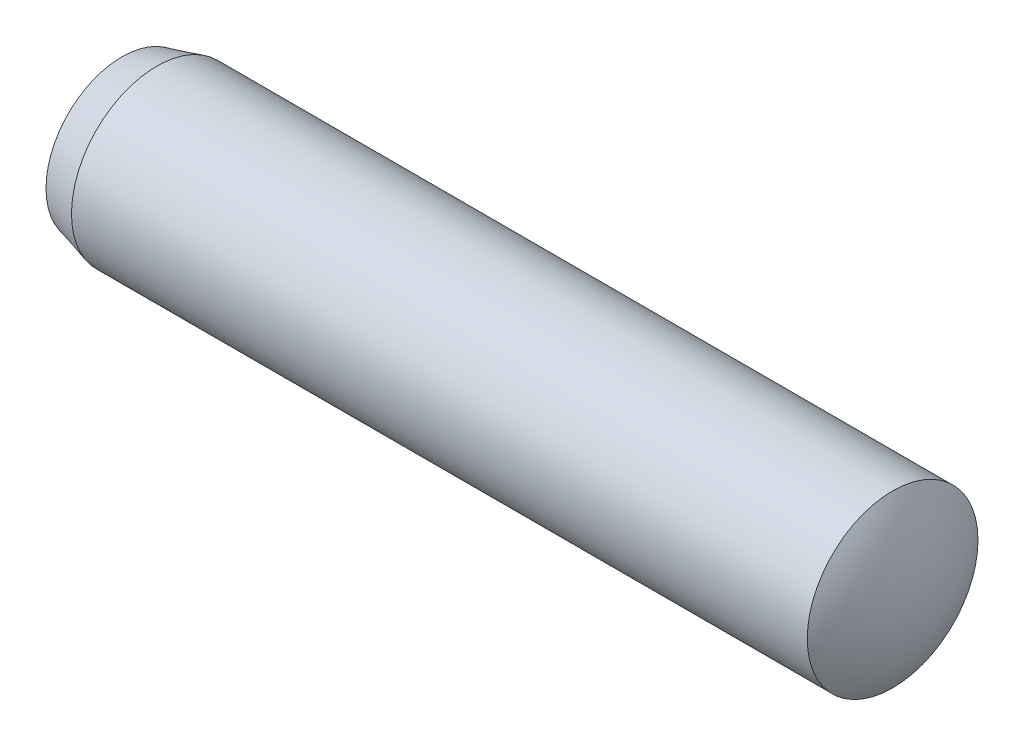
from build123d import *


with BuildPart() as part:
    # Sketch5 → Revolve1 (revolve)
    with BuildSketch(Plane.XY, mode=Mode.PRIVATE) as revolve1_sk:
        with BuildLine():
            Line((-12, 0), (12, 0))
            ThreePointArc((12, 0), (11.808461045, 1.305038314), (11.25, 2.5))
            Line((11.25, 2.5), (-10.3, 2.5))
            Line((-10.3, 2.5), (-11.32, 2.226691824))
            ThreePointArc((-11.32, 2.226691824), (-11.826211137, 1.164104428), (-12, 0))
        make_face()
    revolve(revolve1_sk.sketch.rotate(Axis((-12, 0, 0), (1, 0, 0)), 180), axis=Axis((-12, 0, 0), (1, 0, 0)))


solid = part.part
